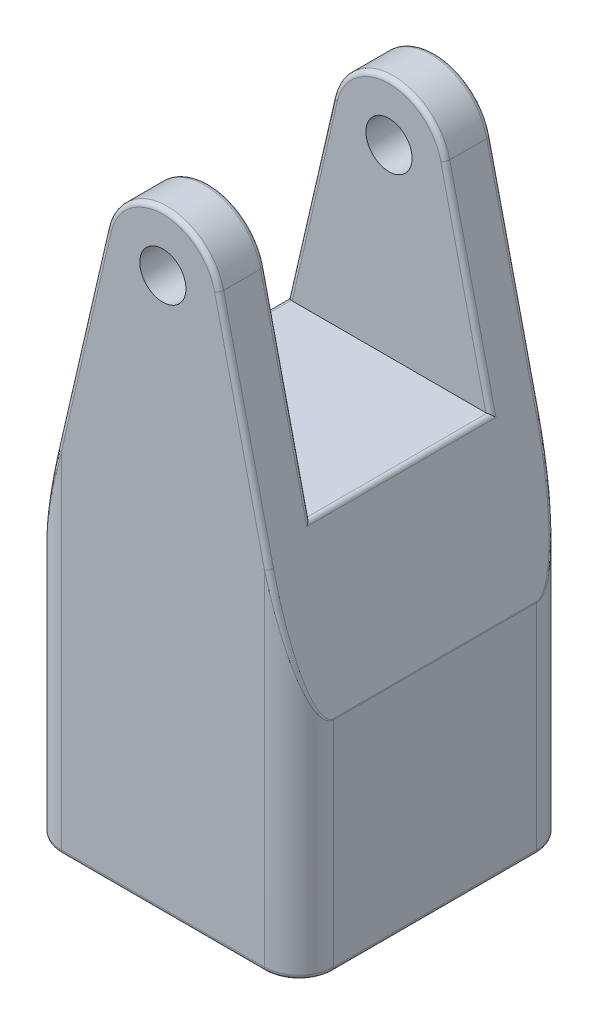
from build123d import *

# Parameters (mm, degrees)
EXTRUDE_1_DEPTH     = 9.5
EXTRUDE_2_DEPTH     = 11.8
EXTRUDE_3_DEPTH     = 2
CUT_EXTRUDE_1_REACH = 31.556
SKETCH_4_R          = 1.0000000000000002
FILLET_1_R          = 1.5
FILLET_2_R          = 0.2


with BuildPart() as part:
    # 草图1 → 凸台-拉伸1 (new body)
    with BuildSketch(Plane(origin=(0, 0, 0), x_dir=(1, 0, 0), z_dir=(0, 1, 0))):
        Polygon((5.899999999999999, 5.9), (5.9, -5.9), (-5.9, -5.900000000000002), (-5.900000000000002, 5.899999999999999), align=None)
    extrude(amount=EXTRUDE_1_DEPTH)

    # 草图2 → 凸台-拉伸2 (add)
    with BuildSketch(Plane.XY.offset(5.900000000000001)):
        Polygon((-5.900000000000001, 9.5), (5.8999999999999995, 9.5), (4.3999999999999995, 16), (-4.400000000000001, 16), align=None)
    extrude(amount=-EXTRUDE_2_DEPTH)

    # 草图3 → 凸台-拉伸3 (add)
    with BuildSketch(Plane.XY.offset(5.900000000000001)):
        with BuildLine():
            Line((-4.400000000000001, 16), (4.3999999999999995, 16))
            Line((4.3999999999999995, 16), (2.435977989236515, 24.510762046641762))
            ThreePointArc((2.435977989236515, 24.510762046641762), (-4.169e-14, 26.448613279894865), (-2.435977989236587, 24.510762046641744))
            Line((-2.435977989236587, 24.510762046641744), (-4.400000000000001, 16))
        make_face()
    extrude_3 = extrude(amount=-EXTRUDE_3_DEPTH)

    # 草图4 → 切除-拉伸1 (cut, up to next)
    with BuildSketch(Plane.XY.offset(5.900000000000001), mode=Mode.PRIVATE) as cut_extrude_1_sk1:
        with Locations((-3.296e-14, 23.948613279894865)):
            Circle(SKETCH_4_R)
    cut_extrude_1_tool1 = extrude(cut_extrude_1_sk1.sketch, amount=-CUT_EXTRUDE_1_REACH, mode=Mode.PRIVATE) & part.part
    cut_extrude_1 = cut_extrude_1_tool1.solids().sort_by_distance((0, 23.948613, 5.9))[0]
    add(cut_extrude_1, mode=Mode.SUBTRACT)

    # 镜向1: 凸台-拉伸3, 切除-拉伸1 across plane
    add(extrude_3.mirror(Plane.XY))
    add(cut_extrude_1.mirror(Plane.XY), mode=Mode.SUBTRACT)

    # 草图5 → 切除-旋转1 (revolve, cut)
    with BuildSketch(Plane.XY, mode=Mode.PRIVATE) as cut_revolve_1_sk:
        Polygon((0, 0), (0, 14), (3, 14), (3.999999999999999, 9.5), (4, 0), align=None)
    revolve(cut_revolve_1_sk.sketch.rotate(Axis((0, 0, 0), (0, 1, 0)), 90), axis=Axis((0, 0, 0), (0, 1, 0)), mode=Mode.SUBTRACT)

    # 圆角1
    fillet_1_edges = [part.edges().sort_by_distance(p)[0] for p in [
        (5.899999999999999, 4.75, -5.9),
        (5.9, 4.75, 5.9),
        (-5.9, 4.75, 5.900000000000002),
        (-5.900000000000002, 4.75, -5.899999999999999),
    ]]
    fillet(fillet_1_edges, radius=FILLET_1_R)

    # 圆角2
    fillet_2_edges = [part.edges().sort_by_distance(p)[0] for p in [
        (3.417988994618258, 20.25538102332088, 5.900000000000001),
        (5.19350478455585, 12.56147926692465, 5.672929753319866),
        (5.8999999999999995, 9.5, -8.9e-16),
        (5.193504784555849, 12.561479266924657, -5.672929753319866),
        (3.4179889946182564, 20.255381023320886, -5.9),
        (-4.254e-14, 26.448613279894865, -5.900000000000001),
        (-4.254e-14, 26.448613279894865, -3.9000000000000012),
        (-3.417988994618308, 20.255381023320872, -5.9),
        (-5.193504714374944, 12.561479571041913, -5.672929797068456),
        (-5.900000000000001, 9.5, 1.78e-15),
        (-5.193504714374941, 12.561479571041922, 5.672929797068459),
        (-3.4179889946183075, 20.255381023320876, 5.900000000000001),
        (0, 0, 5.900000000000001),
        (5.460660171779821, 0, 5.460660171779821),
        (5.8999999999999995, 0, 0),
        (5.4606601717798195, 0, -5.460660171779821),
        (-1.78e-15, 0, -5.8999999999999995),
        (-5.460660171779823, 0, -5.4606601717798195),
        (-5.900000000000001, 0, 1.78e-15),
        (-4.254e-14, 26.448613279894865, 5.900000000000001),
        (-4.254e-14, 26.448613279894865, 3.9000000000000012),
        (-5.460660171779821, 0, 5.460660171779823),
        (3.4179889946182582, 20.25538102332088, 3.9000000000000012),
        (-3.4179889946182938, 20.255381023320872, -3.9000000000000012),
        (3.4179889946182582, 20.25538102332088, -3.9000000000000012),
        (4.4, 16, 0),
        (-3.4179889946182933, 20.255381023320872, 3.9000000000000012),
        (-4.4, 16, 0),
    ]]
    fillet(fillet_2_edges, radius=FILLET_2_R)


solid = part.part
